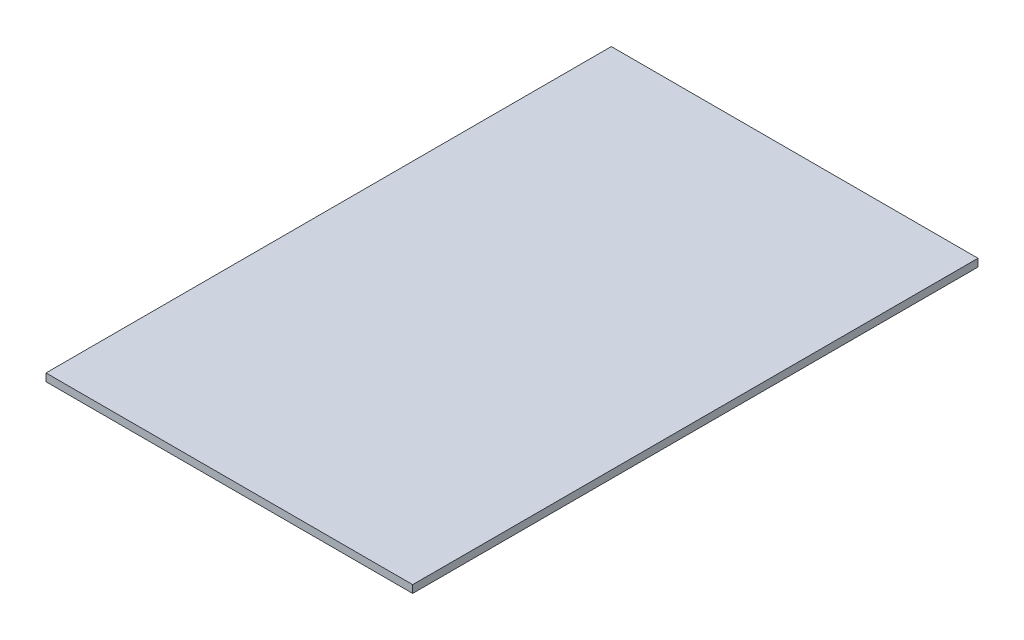
from build123d import *

# Parameters (mm, degrees)
SKETCH1_W           = 304.8
SKETCH1_H           = 469.9
BOSS_EXTRUDE1_DEPTH = 6.35


with BuildPart() as part:
    # Sketch1 → Boss-Extrude1 (new body)
    with BuildSketch(Plane(origin=(0, 0, 0), x_dir=(1, 0, 0), z_dir=(0, 1, 0))):
        with Locations((152.4, 234.95)):
            Rectangle(SKETCH1_W, SKETCH1_H)
    extrude(amount=BOSS_EXTRUDE1_DEPTH)


solid = part.part
